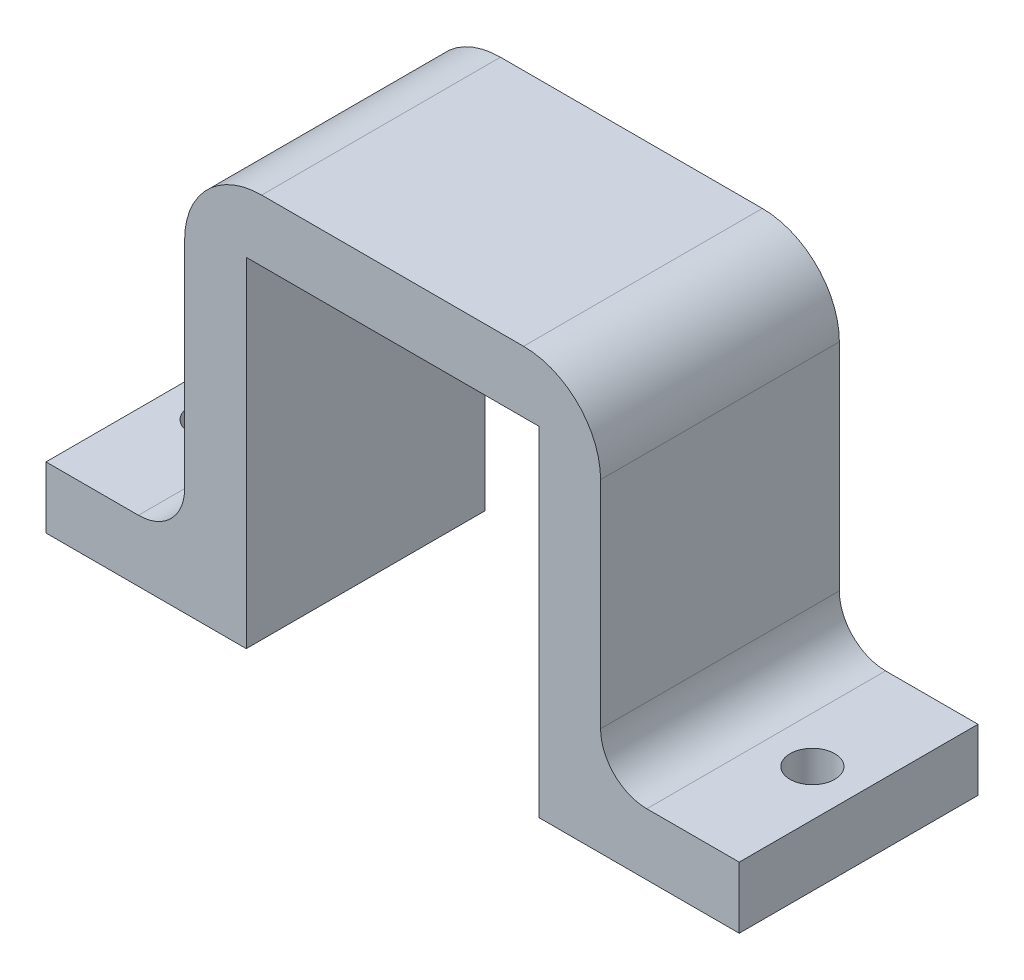
from build123d import *

# Parameters (mm, degrees)
BOSS_EXTRUDE1_DEPTH     = 23
CUT_EXTRUDE2_DEPTH      = 23
CUT_EXTRUDE2_DEPTH_BACK = 10
SKETCH4_W               = 3.5
SKETCH4_H               = 21
SKETCH5_W               = 45
SKETCH5_H               = 7.5
CUT_EXTRUDE3_DEPTH      = 26
SKETCH7_R               = 1.45
CUT_EXTRUDE4_DEPTH      = 26


with BuildPart() as part:
    # Sketch1 → Boss-Extrude1 (new body)
    with BuildSketch(Plane.XY):
        with BuildLine():
            Line((0, 3), (0, 17))
            ThreePointArc((0, 17), (1.464466094, 20.535533906), (5, 22))
            Line((5, 22), (22, 22))
            ThreePointArc((22, 22), (25.535533906, 20.535533906), (27, 17))
            Line((27, 17), (27, 3))
            ThreePointArc((27, 3), (27.878679656, 0.878679656), (30, 0))
            Line((30, 0), (36, 0))
            Line((36, 0), (36, -4))
            Line((36, -4), (23, -4))
            Line((23, -4), (23, 18))
            Line((23, 18), (4, 18))
            Line((4, 18), (4, -4))
            Line((4, -4), (-9, -4))
            Line((-9, -4), (-9, 0))
            Line((-9, 0), (-3, 0))
            ThreePointArc((-3, 0), (-0.878679656, 0.878679656), (0, 3))
        make_face()
    extrude(amount=BOSS_EXTRUDE1_DEPTH)

    # Sketch4 → Cut-Extrude2 (cut, two sides: drawn at the far end of the back side and taken through both)
    with BuildSketch(Plane.ZY.offset(-CUT_EXTRUDE2_DEPTH_BACK)):
        with Locations((5.75, 6.5)):
            Rectangle(SKETCH4_W, SKETCH4_H)
    extrude(amount=CUT_EXTRUDE2_DEPTH + CUT_EXTRUDE2_DEPTH_BACK, mode=Mode.SUBTRACT)

    # Sketch5 → Cut-Extrude3 (cut)
    with BuildSketch(Plane(origin=(0, 22, 0), x_dir=(1, 0, 0), z_dir=(0, 1, 0))):
        with Locations((13.5, -3.75)):
            Rectangle(SKETCH5_W, SKETCH5_H)
    extrude(amount=-CUT_EXTRUDE3_DEPTH, mode=Mode.SUBTRACT)

    # Sketch7 → Cut-Extrude4 (cut)
    with BuildSketch(Plane(origin=(0, 0, 0), x_dir=(1, 0, 0), z_dir=(0, 1, 0))):
        with Locations(Location((-6, -15.25, 0), (0, 0, 270))):
            Circle(SKETCH7_R)
        with Locations(Location((33, -15.25, 0), (0, 0, 180))):
            Circle(SKETCH7_R)
    extrude(amount=-CUT_EXTRUDE4_DEPTH, mode=Mode.SUBTRACT)


solid = part.part
